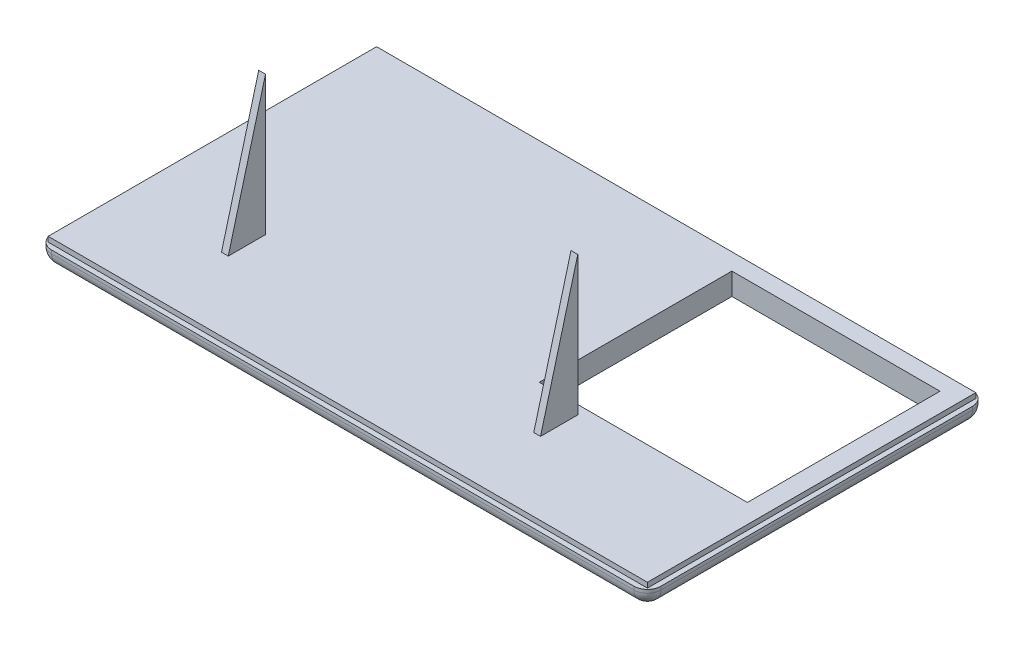
from build123d import *

# Parameters (mm, degrees)
SKETCH1_W               = 180
SKETCH1_H               = 100
BOSS_EXTRUDE1_DEPTH     = 5
SKETCH2_W               = 177
SKETCH2_H               = 97
BOSS_EXTRUDE2_DEPTH     = 1.5
CUT_EXTRUDE1_REACH      = 120.309
SKETCH3_W               = 61.468
SKETCH3_H               = 56.896
FILLET3_R               = 4
FILLET4_R               = 4
SKETCH5_W               = 2
SKETCH5_H               = 11
BOSS_EXTRUDE3_DEPTH     = 55
SKETCH7_W               = 2
SKETCH7_H               = 11
BOSS_EXTRUDE4_DEPTH     = 55
CUT_EXTRUDE3_DEPTH      = 153.194061156
CUT_EXTRUDE3_DEPTH_BACK = 153.194061156


with BuildPart() as part:
    # Sketch1 → Boss-Extrude1 (new body)
    with BuildSketch(Plane(origin=(0, 0, 0), x_dir=(1, 0, 0), z_dir=(0, 1, 0))):
        with Locations((11.492537313, -10.447761194)):
            Rectangle(SKETCH1_W, SKETCH1_H)
    extrude(amount=BOSS_EXTRUDE1_DEPTH)

    # Sketch2 → Boss-Extrude2 (add)
    with BuildSketch(Plane(origin=(0, 5, 0), x_dir=(1, 0, 0), z_dir=(0, 1, 0))):
        with Locations((11.492537313, -10.447761194)):
            Rectangle(SKETCH2_W, SKETCH2_H)
    extrude(amount=BOSS_EXTRUDE2_DEPTH)

    # Sketch3 → Cut-Extrude1 (cut, up to next)
    with BuildSketch(Plane(origin=(0, 6.5, 0), x_dir=(1, 0, 0), z_dir=(0, 1, 0)), mode=Mode.PRIVATE) as cut_extrude1_sk1:
        with Locations((63.60476585, 4.678190655)):
            Rectangle(SKETCH3_W, SKETCH3_H)
    cut_extrude1_tool1 = extrude(cut_extrude1_sk1.sketch, amount=-CUT_EXTRUDE1_REACH, mode=Mode.PRIVATE) & part.part
    add(cut_extrude1_tool1.solids().sort_by_distance((63.604766, 6.5, -4.678191))[0], mode=Mode.SUBTRACT)

    # Fillet3
    fillet3_edges = [part.edges().sort_by_distance(p)[0] for p in [
        (-78.507462687, 2.5, -39.552238806),
        (101.492537313, 2.5, -39.552238806),
        (101.492537313, 2.5, 60.447761194),
        (-78.507462687, 2.5, 60.447761194),
    ]]
    fillet(fillet3_edges, radius=FILLET3_R)

    # Fillet4
    fillet4_edges = [part.edges().sort_by_distance(p)[0] for p in [
        (11.492537313, 0, 60.447761194),
        (-78.507462687, 0, 10.447761194),
        (11.492537313, 0, -39.552238806),
        (101.492537313, 0, 10.447761194),
        (100.320964438, 0, 59.276188319),
        (100.320964438, 0, -38.380665931),
        (-77.335889811, 0, -38.380665931),
        (-77.335889811, 0, 59.276188319),
    ]]
    fillet(fillet4_edges, radius=FILLET4_R)

    # Sketch5 → Boss-Extrude3 (add)
    with BuildSketch(Plane(origin=(0, 6.5, 0), x_dir=(1, 0, 0), z_dir=(0, 1, 0))):
        with Locations((-46.337817573, -31.927761194)):
            Rectangle(SKETCH5_W, SKETCH5_H)
    extrude(amount=BOSS_EXTRUDE3_DEPTH)

    # Sketch7 → Boss-Extrude4 (add)
    with BuildSketch(Plane(origin=(0, 6.5, 0), x_dir=(1, 0, 0), z_dir=(0, 1, 0))):
        with Locations((45.899277236, -31.927761194)):
            Rectangle(SKETCH7_W, SKETCH7_H)
    extrude(amount=BOSS_EXTRUDE4_DEPTH)

    # Sketch8 → Cut-Extrude3 (cut, two sides: drawn at the far end of the back side and taken through both)
    with BuildSketch(Plane(origin=(46.899277236, 0, 0), x_dir=(0, 0, -1), z_dir=(1, 0, 0)).offset(-CUT_EXTRUDE3_DEPTH_BACK)):
        Polygon((-37.427761194, 61.5), (-37.427761194, 6.5), (-26.427761194, 47.552558883), (-26.427761194, 61.5), align=None)
    extrude(amount=CUT_EXTRUDE3_DEPTH + CUT_EXTRUDE3_DEPTH_BACK, mode=Mode.SUBTRACT)


solid = part.part
